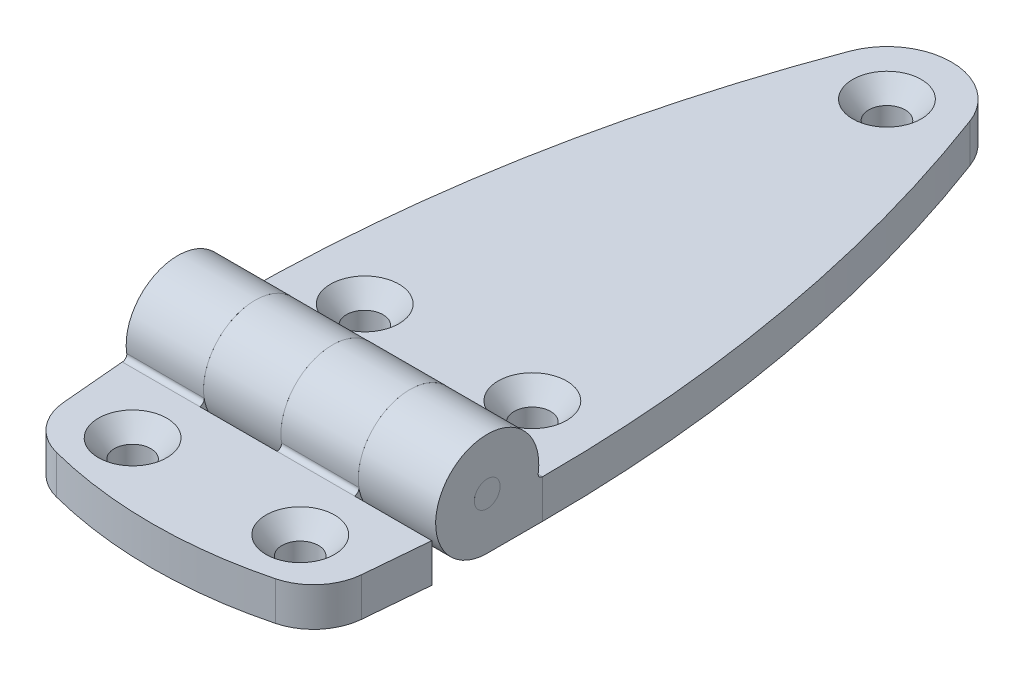
from build123d import *

# Parameters (mm, degrees)
SKETCH2_R                                     = 1.5875
EXTRUDE1_DEPTH                                = 19.05
SKETCH24_W                                    = 9.525
SKETCH24_H                                    = 13.174082694
CUT_EXTRUDE5_DEPTH                            = 32.908355097
EXTRUDE2_REACH                                = 33.908
SKETCH4_R                                     = 1.5875
EXTRUDE2_DIRECTION_2_REACH                    = 33.908
SKETCH25_W                                    = 9.525
SKETCH25_H                                    = 13.174082694
CUT_EXTRUDE6_DEPTH                            = 80.565271947
SKETCH7_W                                     = 38.1
SKETCH7_H                                     = 1.5875
CUT_EXTRUDE4_DEPTH                            = 1056.132
CSK_FOR_8_FLAT_HEAD_MACHINE_SCREW1_AT_2_COUNT = 2
CSK_FOR_8_FLAT_HEAD_MACHINE_SCREW1_AT_2_PITCH = 54.95249973
CSK_FOR_8_FLAT_HEAD_MACHINE_SCREW1_AT_3_COUNT = 2
CSK_FOR_8_FLAT_HEAD_MACHINE_SCREW1_AT_3_PITCH = 54.95249973
CSK_FOR_8_FLAT_HEAD_MACHINE_SCREW1_AT_4_COUNT = 2
CSK_FOR_8_FLAT_HEAD_MACHINE_SCREW1_AT_4_PITCH = 83.19242214
CSK_FOR_8_FLAT_HEAD_MACHINE_SCREW1_AT_5_COUNT = 2
CSK_FOR_8_FLAT_HEAD_MACHINE_SCREW1_AT_5_PITCH = 83.19242214


with BuildPart() as part:
    # Sketch2 → Extrude1 (new, symmetric)
    with BuildSketch(Plane(origin=(0, 0, 0), x_dir=(0, 0, -1), z_dir=(1, 0, 0))):
        with BuildLine():
            Line((0, 0), (-22.225, 0))
            Line((-22.225, 0), (-22.225, 4.7625))
            Line((-22.225, 4.7625), (-6.824082694, 4.7625))
            ThreePointArc((-6.824082694, 4.7625), (-6.405376094, 4.954700563), (-6.278156079, 5.3975))
            ThreePointArc((-6.278156079, 5.3975), (4.139693527, 11.165125907), (0, 0))
        make_face()
        with Locations(Location((0, 6.35, 0), (0, 0, 180))):
            Circle(SKETCH2_R, mode=Mode.SUBTRACT)
    extrude(amount=EXTRUDE1_DEPTH, both=True)

    # Sketch24 → Cut-Extrude5 (cut, through all)
    with BuildSketch(Plane(origin=(0, 0, 0), x_dir=(1, 0, 0), z_dir=(0, 1, 0))):
        with Locations((-4.7625, -0.237041347)):
            Rectangle(SKETCH24_W, SKETCH24_H)
        with Locations((14.2875, -0.237041347)):
            Rectangle(SKETCH24_W, SKETCH24_H)
    extrude(amount=CUT_EXTRUDE5_DEPTH, mode=Mode.SUBTRACT)


with BuildPart() as body_2:

    # Extrude2: up to this face of the body (flat: up to its plane)
    extrude2_end = Plane(part.part.faces().sort_by_distance((19.05, 2.38125, 14.524541347))[0])
    # Sketch4 → Extrude2 (new, up to the picked face)
    with BuildSketch(Plane(origin=(0, 0, 0), x_dir=(0, 0, -1), z_dir=(1, 0, 0)), mode=Mode.PRIVATE) as extrude2_sk1:
        with BuildLine():
            Line((0, 0), (76.2, 0))
            Line((76.2, 0), (76.2, 4.7625))
            Line((76.2, 4.7625), (6.824082694, 4.7625))
            ThreePointArc((6.824082694, 4.7625), (6.405376094, 4.954700563), (6.278156079, 5.3975))
            ThreePointArc((6.278156079, 5.3975), (-4.139693527, 11.165125907), (0, 0))
        make_face()
        with Locations((0, 6.35)):
            Circle(SKETCH4_R, mode=Mode.SUBTRACT)
    extrude2_tool1 = split(extrude(extrude2_sk1.sketch, amount=EXTRUDE2_REACH, mode=Mode.PRIVATE), bisect_by=extrude2_end, keep=Keep.BOTH, mode=Mode.PRIVATE)
    add(extrude2_tool1.solids().sort_by(Axis((0, 3.387521, -29.937406), (1, 0, 0)))[0])


    # Extrude2 direction 2: up to this face of the body (flat: up to its plane)
    extrude2_direction_2_end = Plane(part.part.faces().sort_by_distance((-19.05, 4.661678537, 5.530933407))[0])
    # Sketch4 → Extrude2 direction 2 (add, up to the picked face)
    with BuildSketch(Plane(origin=(0, 0, 0), x_dir=(0, 0, -1), z_dir=(1, 0, 0)), mode=Mode.PRIVATE) as extrude2_direction_2_sk1:
        with BuildLine():
            Line((0, 0), (76.2, 0))
            Line((76.2, 0), (76.2, 4.7625))
            Line((76.2, 4.7625), (6.824082694, 4.7625))
            ThreePointArc((6.824082694, 4.7625), (6.405376094, 4.954700563), (6.278156079, 5.3975))
            ThreePointArc((6.278156079, 5.3975), (-4.139693527, 11.165125907), (0, 0))
        make_face()
        with Locations((0, 6.35)):
            Circle(SKETCH4_R, mode=Mode.SUBTRACT)
    extrude2_direction_2_tool1 = split(extrude(extrude2_direction_2_sk1.sketch, amount=-EXTRUDE2_DIRECTION_2_REACH, mode=Mode.PRIVATE), bisect_by=extrude2_direction_2_end, keep=Keep.BOTH, mode=Mode.PRIVATE)
    add(extrude2_direction_2_tool1.solids().sort_by(Axis((0, 3.387521, -29.937406), (-1, 0, 0)))[0])

    # Sketch25 → Cut-Extrude6 (cut, through all)
    with BuildSketch(Plane(origin=(0, 0, 0), x_dir=(1, 0, 0), z_dir=(0, 1, 0))):
        with Locations((-14.2875, 0.237041347)):
            Rectangle(SKETCH25_W, SKETCH25_H)
        with Locations((4.7625, 0.237041347)):
            Rectangle(SKETCH25_W, SKETCH25_H)
    extrude(amount=CUT_EXTRUDE6_DEPTH, mode=Mode.SUBTRACT)


with BuildPart() as body_3:
    # Sketch7 → Revolve1 (revolve)
    with BuildSketch(Plane(origin=(0, 6.35, 0), x_dir=(-1, 0, 0), z_dir=(0, 1, 0)), mode=Mode.PRIVATE) as revolve1_sk:
        with Locations((0, -0.79375)):
            Rectangle(SKETCH7_W, SKETCH7_H)
    revolve(revolve1_sk.sketch.rotate(Axis((19.05, 6.35, 0), (-1, 0, 0)), 180), axis=Axis((19.05, 6.35, 0), (-1, 0, 0)))


with BuildPart() as cut_extrude4_tool:
    # Sketch8 → Cut-Extrude4 (new body)
    with BuildSketch(Plane(origin=(0, 4.7625, 0), x_dir=(-1, 0, 0), z_dir=(0, 1, 0))):
        with BuildLine():
            Line((-19.05, -6.824082694), (-22.119129983, -6.824082694))
            Line((-22.119129983, -6.824082694), (-22.119129983, -80.12356523))
            Line((-22.119129983, -80.12356523), (22.119129983, -80.12356523))
            Line((22.119129983, -80.12356523), (22.119129983, -6.824082694))
            Line((22.119129983, -6.824082694), (19.05, -6.824082694))
            ThreePointArc((19.05, -6.824082694), (16.122782432, -39.454483022), (7.434605523, -71.042886119))
            ThreePointArc((7.434605523, -71.042886119), (0, -76.2), (-7.434605523, -71.042886119))
            ThreePointArc((-7.434605523, -71.042886119), (-16.122782432, -39.454483022), (-19.05, -6.824082694))
        make_face()
        with BuildLine():
            Line((-19.05, 6.824082694), (-18.355558733, 14.761582694))
            ThreePointArc((-18.355558733, 14.761582694), (-16.836967363, 18.406050054), (-13.49375, 20.506326167))
            ThreePointArc((-13.49375, 20.506326167), (0, 22.225), (13.49375, 20.506326167))
            ThreePointArc((13.49375, 20.506326167), (16.836967363, 18.406050054), (18.355558733, 14.761582694))
            Line((18.355558733, 14.761582694), (19.05, 6.824082694))
            Line((19.05, 6.824082694), (22.119129983, 6.824082694))
            Line((22.119129983, 6.824082694), (22.119129983, 26.600148172))
            Line((22.119129983, 26.600148172), (-22.119129983, 26.600148172))
            Line((-22.119129983, 26.600148172), (-22.119129983, 6.824082694))
            Line((-22.119129983, 6.824082694), (-19.05, 6.824082694))
        make_face()
    extrude(amount=-CUT_EXTRUDE4_DEPTH)


with BuildPart() as part_1:
    add(part.part)

    # Cut-Extrude4: cut by cut_extrude4_tool
    add(cut_extrude4_tool.part, mode=Mode.SUBTRACT)


with BuildPart() as body_2_1:
    add(body_2.part)

    # Cut-Extrude4: cut by cut_extrude4_tool
    add(cut_extrude4_tool.part, mode=Mode.SUBTRACT)

    # Sketch13 → CSK for #8 Flat Head Machine Screw1 (revolve, cut)
    with BuildSketch(Plane(origin=(0, 4.7625, -68.2625), x_dir=(0, 0, 1), z_dir=(1, 0, 0))):
        Polygon((0, 0), (0, 4.7625), (2.2479, 4.7625), (2.2479, 2.26450021), (4.2164, 0), align=None)
    csk_for_8_flat_head_machine_screw1 = revolve(axis=Axis((0, 11.1125, -68.2625), (0, -1, 0)), mode=Mode.SUBTRACT)

    # CSK for #8 Flat Head Machine Screw1 at 2: CSK for #8 Flat Head Machine Screw1 ×2
    with Locations(*[Vector(-0.18777580730124982, 0, 0.9822119151142303) * (i * CSK_FOR_8_FLAT_HEAD_MACHINE_SCREW1_AT_2_PITCH) for i in range(1, CSK_FOR_8_FLAT_HEAD_MACHINE_SCREW1_AT_2_COUNT)]):
        add(csk_for_8_flat_head_machine_screw1, mode=Mode.SUBTRACT)

    # CSK for #8 Flat Head Machine Screw1 at 3: CSK for #8 Flat Head Machine Screw1 ×2
    with Locations(*[Vector(0.18777580730125004, 0, 0.9822119151142303) * (i * CSK_FOR_8_FLAT_HEAD_MACHINE_SCREW1_AT_3_PITCH) for i in range(1, CSK_FOR_8_FLAT_HEAD_MACHINE_SCREW1_AT_3_COUNT)]):
        add(csk_for_8_flat_head_machine_screw1, mode=Mode.SUBTRACT)


with BuildPart() as part_2:
    add(part_1.part)

    # CSK for #8 Flat Head Machine Screw1 at 4: CSK for #8 Flat Head Machine Screw1 ×2
    with Locations(*[Vector(-0.12403473458920831, 0, 0.9922778767136677) * (i * CSK_FOR_8_FLAT_HEAD_MACHINE_SCREW1_AT_4_PITCH) for i in range(1, CSK_FOR_8_FLAT_HEAD_MACHINE_SCREW1_AT_4_COUNT)]):
        add(csk_for_8_flat_head_machine_screw1, mode=Mode.SUBTRACT)

    # CSK for #8 Flat Head Machine Screw1 at 5: CSK for #8 Flat Head Machine Screw1 ×2
    with Locations(*[Vector(0.12403473458920854, 0, 0.9922778767136676) * (i * CSK_FOR_8_FLAT_HEAD_MACHINE_SCREW1_AT_5_PITCH) for i in range(1, CSK_FOR_8_FLAT_HEAD_MACHINE_SCREW1_AT_5_COUNT)]):
        add(csk_for_8_flat_head_machine_screw1, mode=Mode.SUBTRACT)


solid = Compound([body_3.part, body_2_1.part, part_2.part])
